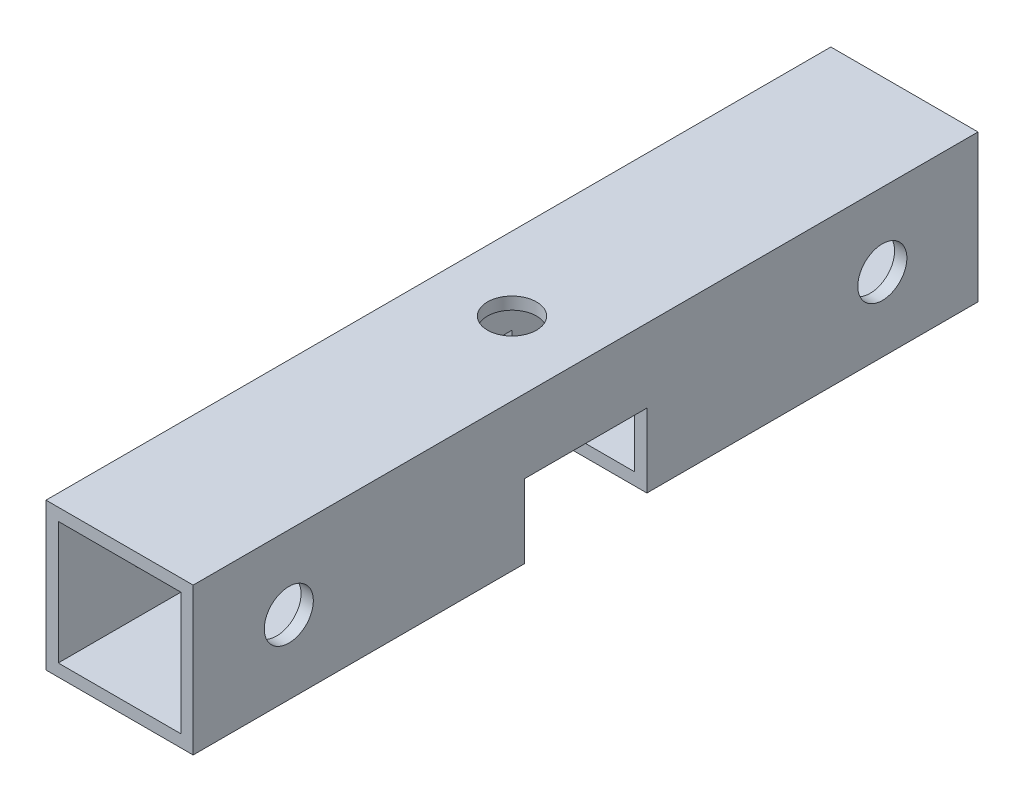
from build123d import *

# Parameters (mm, degrees)
SKETCH1_W           = 19.05
SKETCH1_H           = 19.05
SKETCH1_W_2         = 15.875
SKETCH1_H_2         = 15.875
BOSS_EXTRUDE1_DEPTH = 101.6
SKETCH2_R           = 3.175
CUT_EXTRUDE1_DEPTH  = 104.808420299
SKETCH3_R           = 3.175
SKETCH3_W           = 15.875
SKETCH3_H           = 9.525
CUT_EXTRUDE2_DEPTH  = 104.808420299


with BuildPart() as part:
    # Sketch1 → Boss-Extrude1 (new body)
    with BuildSketch(Plane.XY):
        Rectangle(SKETCH1_W, SKETCH1_H)
        Rectangle(SKETCH1_W_2, SKETCH1_H_2, mode=Mode.SUBTRACT)
    extrude(amount=BOSS_EXTRUDE1_DEPTH)

    # Sketch2 → Cut-Extrude1 (cut, through all)
    with BuildSketch(Plane(origin=(0, 9.525, 0), x_dir=(1, 0, 0), z_dir=(0, 1, 0))):
        with Locations(Location((0, -50.8, 0), (0, 0, 270))):
            Circle(SKETCH2_R)
    extrude(amount=-CUT_EXTRUDE1_DEPTH, mode=Mode.SUBTRACT)

    # Sketch3 → Cut-Extrude2 (cut, through all)
    with BuildSketch(Plane(origin=(9.525, 0, 0), x_dir=(0, 0, -1), z_dir=(1, 0, 0))):
        with Locations((-89.2175, 0)):
            Circle(SKETCH3_R)
        with Locations((-12.3825, 0)):
            Circle(SKETCH3_R)
        with Locations((-50.8, -4.7625)):
            Rectangle(SKETCH3_W, SKETCH3_H)
    extrude(amount=-CUT_EXTRUDE2_DEPTH, mode=Mode.SUBTRACT)


solid = part.part
